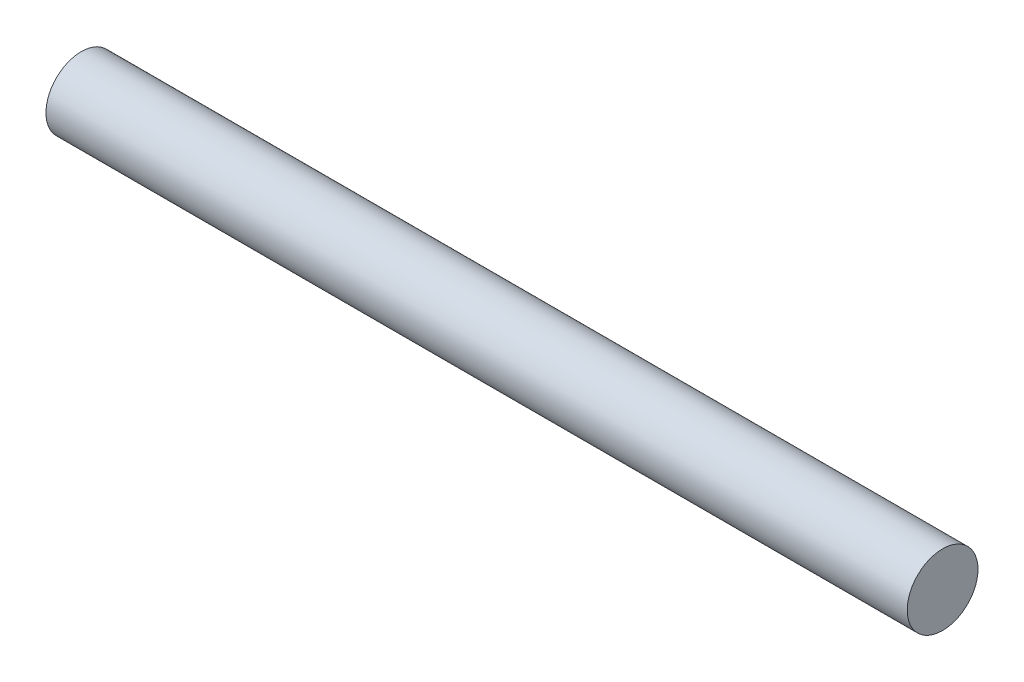
from build123d import *

# Parameters (mm, degrees)
SKETCH2_R           = 1.5
BOSS_EXTRUDE1_DEPTH = 36.5


with BuildPart() as part:
    # Sketch2 → Boss-Extrude1 (new body)
    with BuildSketch(Plane(origin=(0, 0, 0), x_dir=(0, 0, -1), z_dir=(1, 0, 0))):
        Circle(SKETCH2_R)
    extrude(amount=BOSS_EXTRUDE1_DEPTH)


solid = part.part
